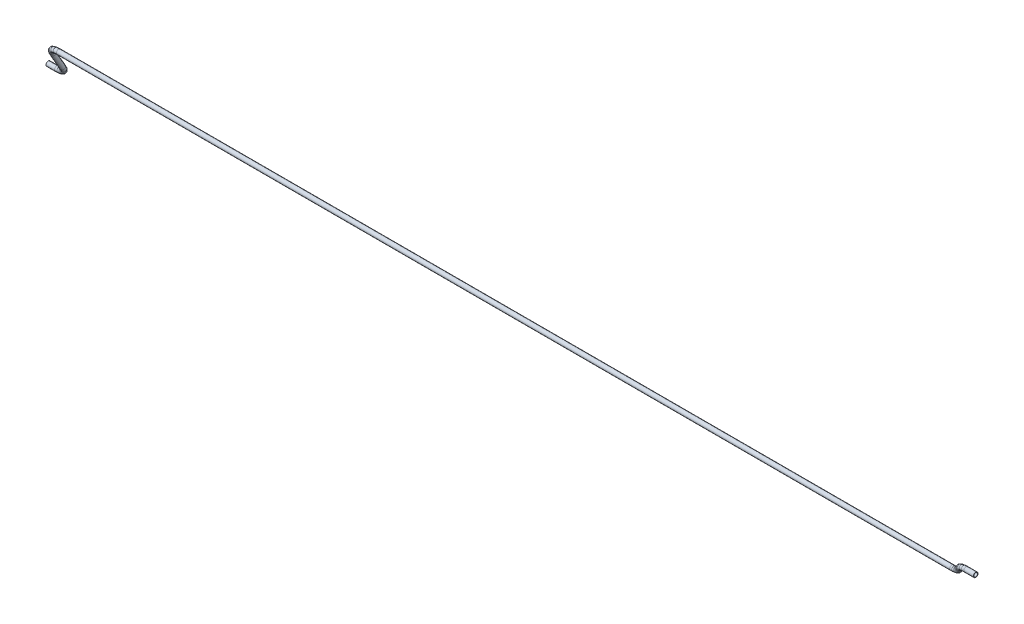
from build123d import *

# Parameters (mm, degrees)
PROFILE_R   = 4.7625
PROFILE_R_2 = 3.8735


with BuildPart() as part:
    # Tube: sweep along a curve in space
    with BuildLine() as tube_path:
        Line((-2155.187960479, 0, 0), (-2137.387960479, 0, 0))
        Line((-2137.387960479, 0, 0), (-2131.176303396, 0.708218401, 0.408890085))
        Line((-2131.176303396, 0.708218401, 0.408890085), (-2125.387960479, 2.784609691, 1.607695155))
        Line((-2125.387960479, 2.784609691, 1.607695155), (-2120.41739773, 6.087671234, 3.514718626))
        Line((-2120.41739773, 6.087671234, 3.514718626), (-2116.603350788, 10.392304845, 6))
        Line((-2116.603350788, 10.392304845, 6), (-2114.205740648, 15.405156858, 8.894171459))
        Line((-2114.205740648, 15.405156858, 8.894171459), (-2113.387960479, 20.784609691, 12))
        Line((-2113.387960479, 20.784609691, 12), (-2113.387960479, 55.425625842, 32))
        Line((-2113.387960479, 55.425625842, 32), (-2112.57018031, 60.805078675, 35.105828541))
        Line((-2112.57018031, 60.805078675, 35.105828541), (-2110.17257017, 65.817930688, 38))
        Line((-2110.17257017, 65.817930688, 38), (-2106.358523227, 70.122564299, 40.485281374))
        Line((-2106.358523227, 70.122564299, 40.485281374), (-2101.387960479, 73.425625842, 42.392304845))
        Line((-2101.387960479, 73.425625842, 42.392304845), (-2095.599617561, 75.502017132, 43.591109915))
        Line((-2095.599617561, 75.502017132, 43.591109915), (-2089.387960479, 76.210235533, 44))
        Line((-2089.387960479, 76.210235533, 44), (-232.899888641, 76.210235533, 44))
        Line((-232.899888641, 76.210235533, 44), (-228.178778023, 76.616343417, 44.234466496))
        Line((-228.178778023, 76.616343417, 44.234466496), (-223.642157782, 77.818797286, 44.928703561))
        Line((-223.642157782, 77.818797286, 44.928703561), (-219.467308827, 79.77060795, 46.055581974))
        Line((-219.467308827, 79.77060795, 46.055581974), (-215.817374859, 82.395503041, 47.571065861))
        Line((-215.817374859, 82.395503041, 47.571065861), (-212.834987083, 85.590907567, 49.415933524))
        Line((-212.834987083, 85.590907567, 49.415933524), (-210.6366905, 89.231952309, 51.518091686))
        Line((-210.6366905, 89.231952309, 51.518091686), (-210.263198141, 90.035306274, 51.981908314))
        Line((-210.263198141, 90.035306274, 51.981908314), (-208.064901558, 93.676351017, 54.084066476))
        Line((-208.064901558, 93.676351017, 54.084066476), (-205.082513782, 96.871755542, 55.928934139))
        Line((-205.082513782, 96.871755542, 55.928934139), (-201.432579814, 99.496650633, 57.444418026))
        Line((-201.432579814, 99.496650633, 57.444418026), (-197.257730859, 101.448461297, 58.571296439))
        Line((-197.257730859, 101.448461297, 58.571296439), (-192.721110618, 102.650915167, 59.265533504))
        Line((-192.721110618, 102.650915167, 59.265533504), (-188, 103.05702305, 59.5))
        Line((-188, 103.05702305, 59.5), (-168.2, 103.05702305, 59.5))
    # Profile → Tube (sweep)
    with BuildSketch(Plane(origin=(-2155.187960479, 0, 0), x_dir=(0, 0, -1), z_dir=(1, 0, 0))):
        Circle(PROFILE_R)
        Circle(PROFILE_R_2, mode=Mode.SUBTRACT)
    sweep(path=tube_path.line, transition=Transition.RIGHT)


solid = part.part
